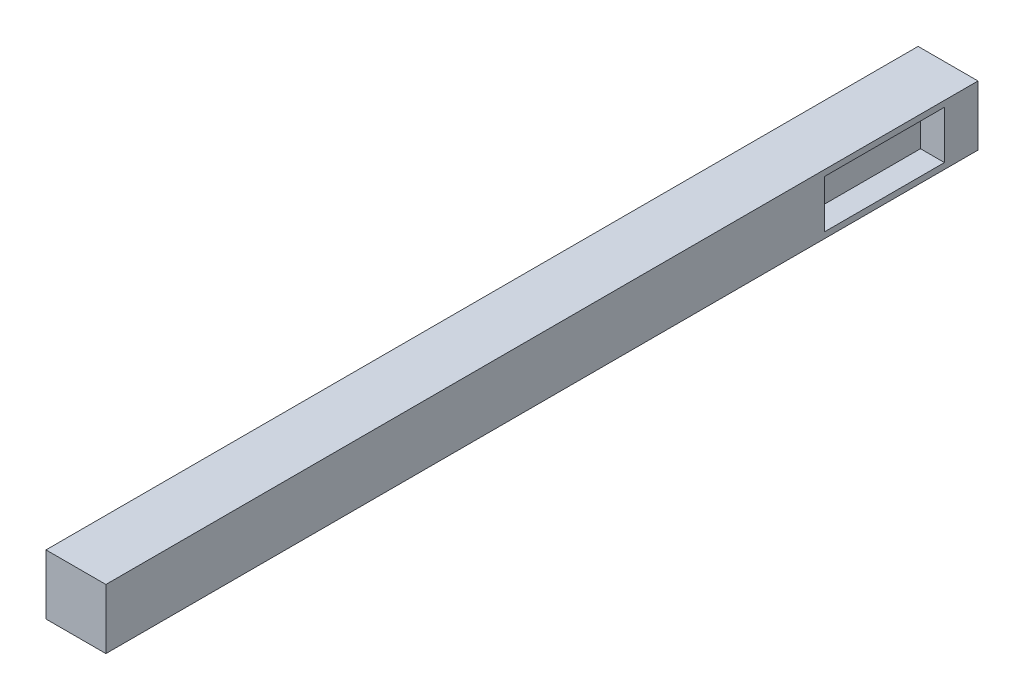
from build123d import *

# Parameters (mm, degrees)
SKETCH1_W           = 25
SKETCH1_H           = 25
BOSS_EXTRUDE1_DEPTH = 364
SKETCH2_W           = 50
SKETCH2_H           = 20
CUT_EXTRUDE1_DEPTH  = 10


with BuildPart() as part:
    # Sketch1 → Boss-Extrude1 (new body)
    with BuildSketch(Plane.XY):
        Rectangle(SKETCH1_W, SKETCH1_H)
    extrude(amount=BOSS_EXTRUDE1_DEPTH)

    # Sketch2 → Cut-Extrude1 (cut)
    with BuildSketch(Plane(origin=(12.5, 0, 0), x_dir=(0, 0, -1), z_dir=(1, 0, 0))):
        with Locations((-39, 0)):
            Rectangle(SKETCH2_W, SKETCH2_H)
    extrude(amount=-CUT_EXTRUDE1_DEPTH, mode=Mode.SUBTRACT)


solid = part.part
